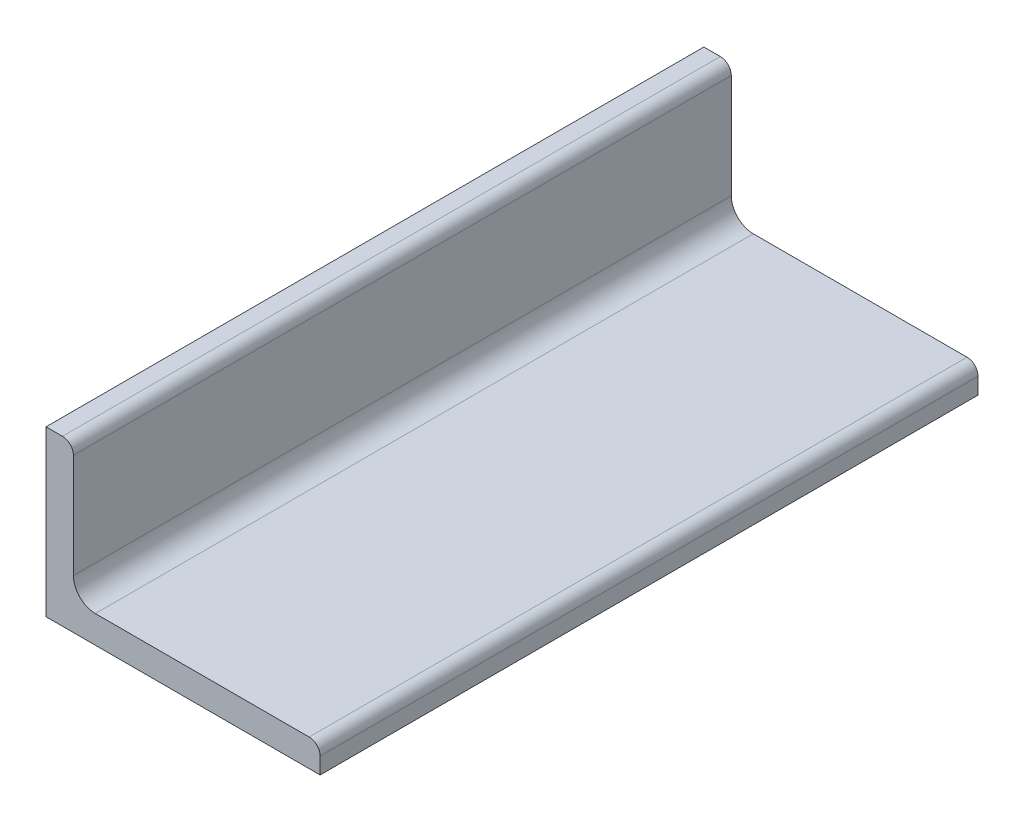
from build123d import *

# Parameters (mm, degrees)
EA_RSA40X40X5_1_DEPTH = 360


with BuildPart() as part:
    # Sketch1 → Ea RSA40X40X5(1) (new body)
    with BuildSketch(Plane.XY.offset(-180)):
        with BuildLine():
            Line((0, 90), (0, 0))
            Line((0, 0), (150, 0))
            Line((150, 0), (150, 9))
            ThreePointArc((150, 9), (148.242640687, 13.242640687), (144, 15))
            Line((144, 15), (27, 15))
            ThreePointArc((27, 15), (18.514718626, 18.514718626), (15, 27))
            Line((15, 27), (15, 84))
            ThreePointArc((15, 84), (13.242640687, 88.242640687), (9, 90))
            Line((9, 90), (0, 90))
        make_face()
    extrude(amount=EA_RSA40X40X5_1_DEPTH)


solid = part.part
